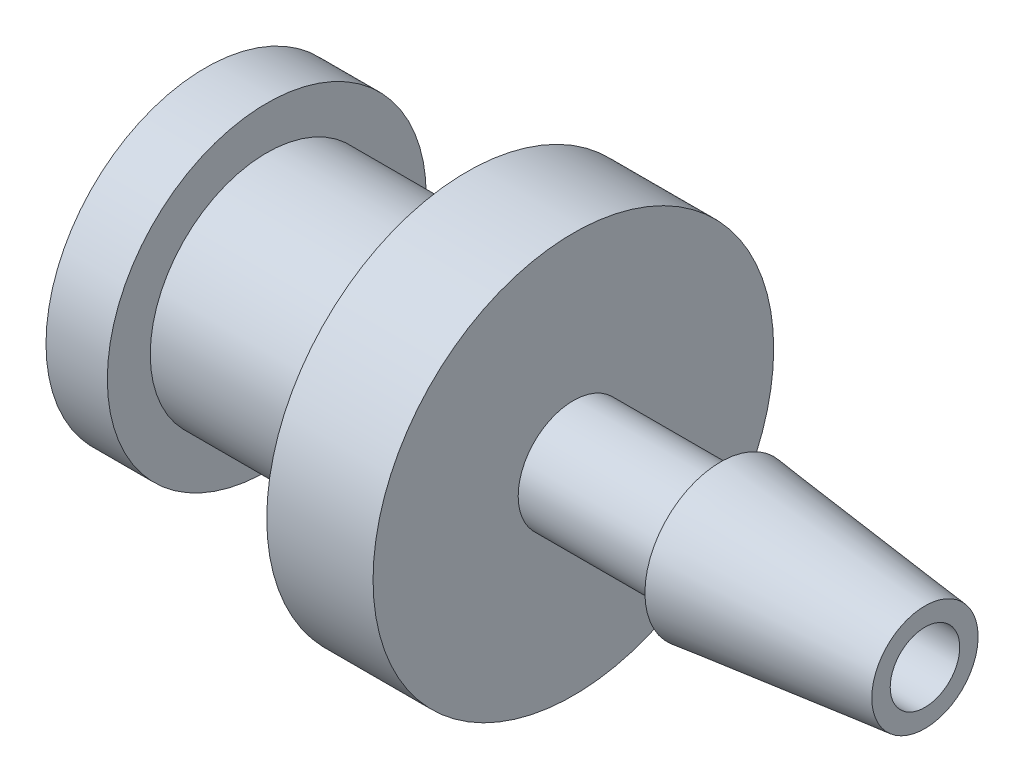
from build123d import *


with BuildPart() as part:
    # Sketch1 → Revolve1 (revolve)
    with BuildSketch(Plane.XY, mode=Mode.PRIVATE) as revolve1_sk:
        Polygon((17.307438017, 0.85), (17.307438017, 1.3), (12.307438017, 1.85), (12.307438017, 1.35), (8.707438017, 1.35), (8.707438017, 4.9), (6.107438017, 4.9), (6.107438017, 2.85), (1.207438017, 2.85), (1.207438017, 3.9), (-0.292561983, 3.9), (-0.292561983, 2.05), (7.907438017, 2.05), (7.907438017, 0.85), align=None)
    revolve(revolve1_sk.sketch.rotate(Axis((-7.165289256, 0, 0), (1, 0, 0)), 90), axis=Axis((-7.165289256, 0, 0), (1, 0, 0)))


solid = part.part
